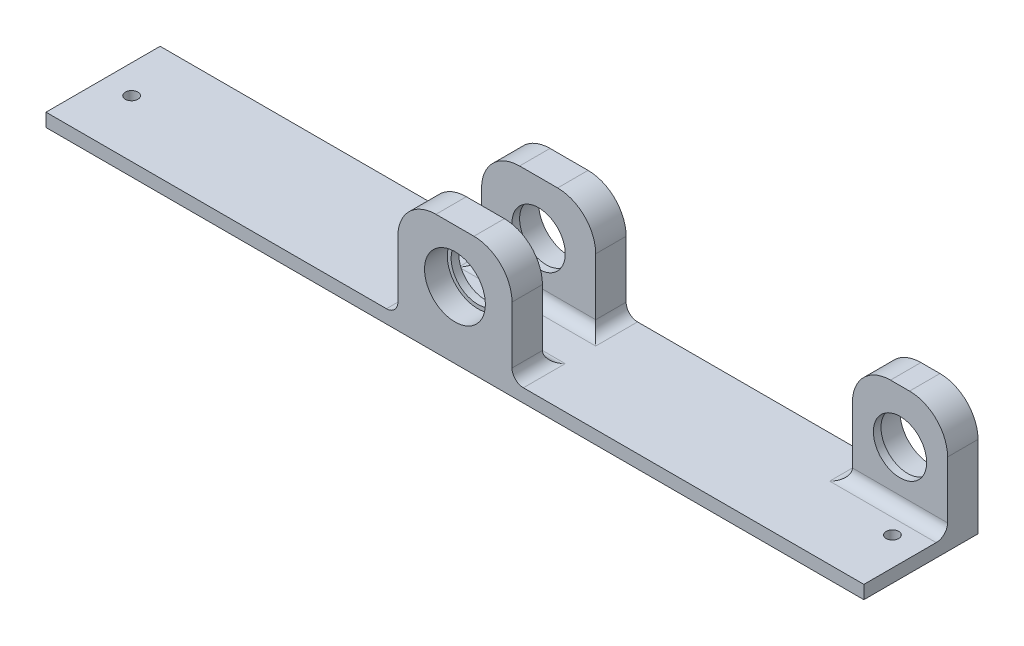
from build123d import *

# Parameters (mm, degrees)
SKETCH2_W                                         = 215
SKETCH2_H                                         = 30
BOSS_EXTRUDE1_DEPTH                               = 3.5
SKETCH4_W                                         = 30
SKETCH4_H                                         = 8
SKETCH4_W_2                                       = 25
BOSS_EXTRUDE2_DEPTH                               = 28
CBORE_FOR_M6_HEX_HEAD_BOLT1_D                     = 14
CBORE_FOR_M6_HEX_HEAD_BOLT1_CBORE_D               = 16
CBORE_FOR_M6_HEX_HEAD_BOLT1_CBORE_DEPTH           = 6
CBORE_FOR_M6_HEX_HEAD_BOLT1_ON_FACE_2_D           = 14
CBORE_FOR_M6_HEX_HEAD_BOLT1_ON_FACE_2_CBORE_D     = 16
CBORE_FOR_M6_HEX_HEAD_BOLT1_ON_FACE_2_CBORE_DEPTH = 6
FILLET1_R                                         = 10
HOLES_TBD_R                                       = 1.65
CUT_EXTRUDE1_DEPTH                                = 113.094825929
FILLET2_R                                         = 3


with BuildPart() as part:
    # Sketch2 → Boss-Extrude1 (new body)
    with BuildSketch(Plane(origin=(0, 0, 0), x_dir=(1, 0, 0), z_dir=(0, 1, 0))):
        Rectangle(SKETCH2_W, SKETCH2_H)
    extrude(amount=BOSS_EXTRUDE1_DEPTH)

    # Sketch4 → Boss-Extrude2 (add)
    with BuildSketch(Plane(origin=(0, 3.5, 0), x_dir=(1, 0, 0), z_dir=(0, 1, 0))):
        with Locations((0, -11)):
            Rectangle(SKETCH4_W, SKETCH4_H)
        with Locations((95, 11)):
            Rectangle(SKETCH4_W_2, SKETCH4_H)
        with Locations((0, 11)):
            Rectangle(SKETCH4_W, SKETCH4_H)
    extrude(amount=BOSS_EXTRUDE2_DEPTH)

    # CBORE for M6 Hex Head Bolt1 (through all)
    with Locations(Plane(origin=(0, 17.5, 15), x_dir=(1, 0, 0), z_dir=(0, 0, 1))):
        with Locations((0, 0)):
            CounterBoreHole(CBORE_FOR_M6_HEX_HEAD_BOLT1_D / 2, CBORE_FOR_M6_HEX_HEAD_BOLT1_CBORE_D / 2, CBORE_FOR_M6_HEX_HEAD_BOLT1_CBORE_DEPTH)

    # CBORE for M6 Hex Head Bolt1 on face 2 (through all)
    with Locations(Plane(origin=(0, 17.5, -15), x_dir=(-1, 0, 0), z_dir=(0, 0, -1))):
        with Locations((0, 0), (-95, 0)):
            CounterBoreHole(CBORE_FOR_M6_HEX_HEAD_BOLT1_ON_FACE_2_D / 2, CBORE_FOR_M6_HEX_HEAD_BOLT1_ON_FACE_2_CBORE_D / 2, CBORE_FOR_M6_HEX_HEAD_BOLT1_ON_FACE_2_CBORE_DEPTH)

    # Fillet1
    fillet1_edges = [part.edges().sort_by_distance(p)[0] for p in [
        (107.5, 31.5, -11),
        (82.5, 31.5, -11),
        (-15, 31.5, 11),
        (15, 31.5, 11),
        (-15, 31.5, -11),
        (15, 31.5, -11),
    ]]
    fillet(fillet1_edges, radius=FILLET1_R)

    # HOLES TBD → Cut-Extrude1 (cut, through all)
    with BuildSketch(Plane(origin=(0, 3.5, 0), x_dir=(1, 0, 0), z_dir=(0, 1, 0))):
        with Locations(Location((-100, 0, 0), (0, 0, 270))):
            Circle(HOLES_TBD_R)
        with Locations(Location((100, 0, 0), (0, 0, 270))):
            Circle(HOLES_TBD_R)
    extrude(amount=-CUT_EXTRUDE1_DEPTH, mode=Mode.SUBTRACT)

    # Fillet2
    fillet2_edges = [part.edges().sort_by_distance(p)[0] for p in [
        (82.5, 3.5, -11),
        (95, 3.5, -7),
        (-15, 3.5, 11),
        (15, 3.5, 11),
        (0, 3.5, 7),
        (-15, 3.5, -11),
        (0, 3.5, -7),
        (15, 3.5, -11),
    ]]
    fillet(fillet2_edges, radius=FILLET2_R)


solid = part.part
